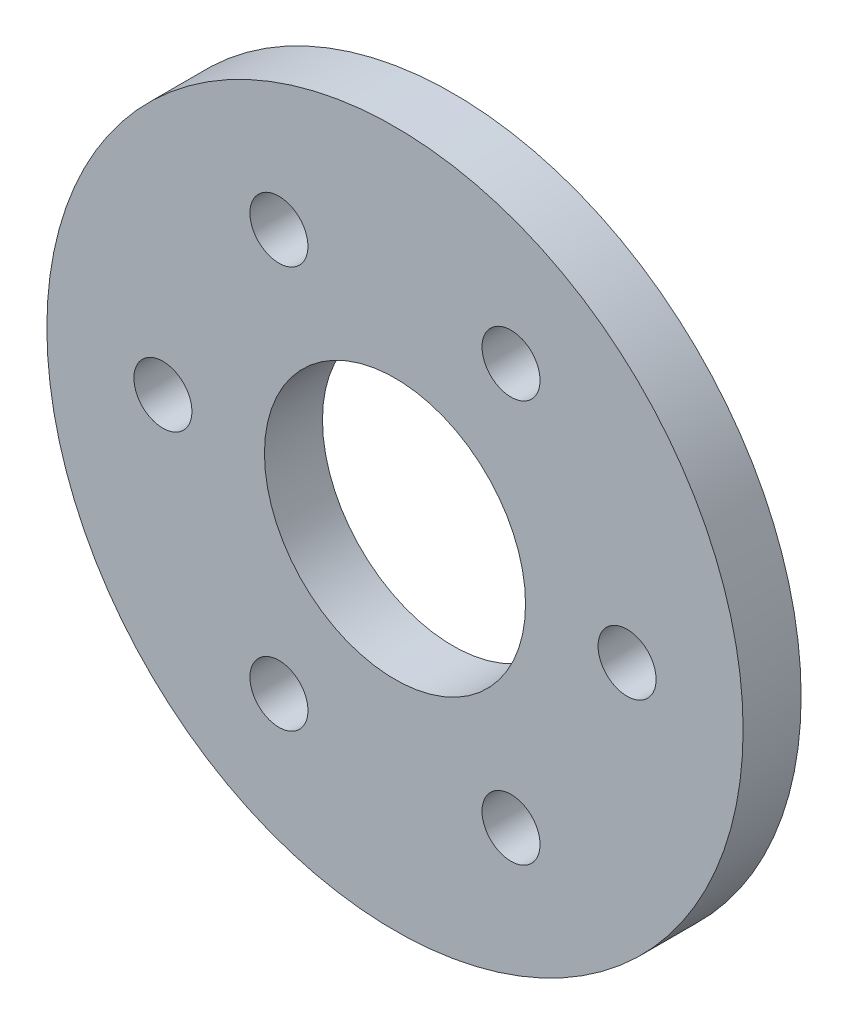
from build123d import *

# Parameters (mm, degrees)
SKETCH1_R           = 38.1
BOSS_EXTRUDE1_DEPTH = 6.35
SKETCH4_R           = 3.175
CUT_EXTRUDE2_DEPTH  = 55.254423783
SKETCH2_R           = 14.2875
CUT_EXTRUDE3_DEPTH  = 55.254423783


with BuildPart() as part:
    # Sketch1 → Boss-Extrude1 (new body)
    with BuildSketch(Plane.XY):
        Circle(SKETCH1_R)
    extrude(amount=BOSS_EXTRUDE1_DEPTH)

    # Sketch4 → Cut-Extrude2 (cut, through all)
    with BuildSketch(Plane(origin=(0, 0, 0), x_dir=(-1, 0, 0), z_dir=(0, 0, -1))):
        with Locations((-25.4, 0)):
            Circle(SKETCH4_R)
        with Locations((-12.7, 21.997045256)):
            Circle(SKETCH4_R)
        with Locations((12.7, 21.997045256)):
            Circle(SKETCH4_R)
        with Locations((25.4, 0)):
            Circle(SKETCH4_R)
        with Locations((12.7, -21.997045256)):
            Circle(SKETCH4_R)
        with Locations((-12.7, -21.997045256)):
            Circle(SKETCH4_R)
    extrude(amount=-CUT_EXTRUDE2_DEPTH, mode=Mode.SUBTRACT)

    # Sketch2 → Cut-Extrude3 (cut, through all)
    with BuildSketch(Plane.XY.offset(6.35)):
        Circle(SKETCH2_R)
    extrude(amount=-CUT_EXTRUDE3_DEPTH, mode=Mode.SUBTRACT)


solid = part.part
